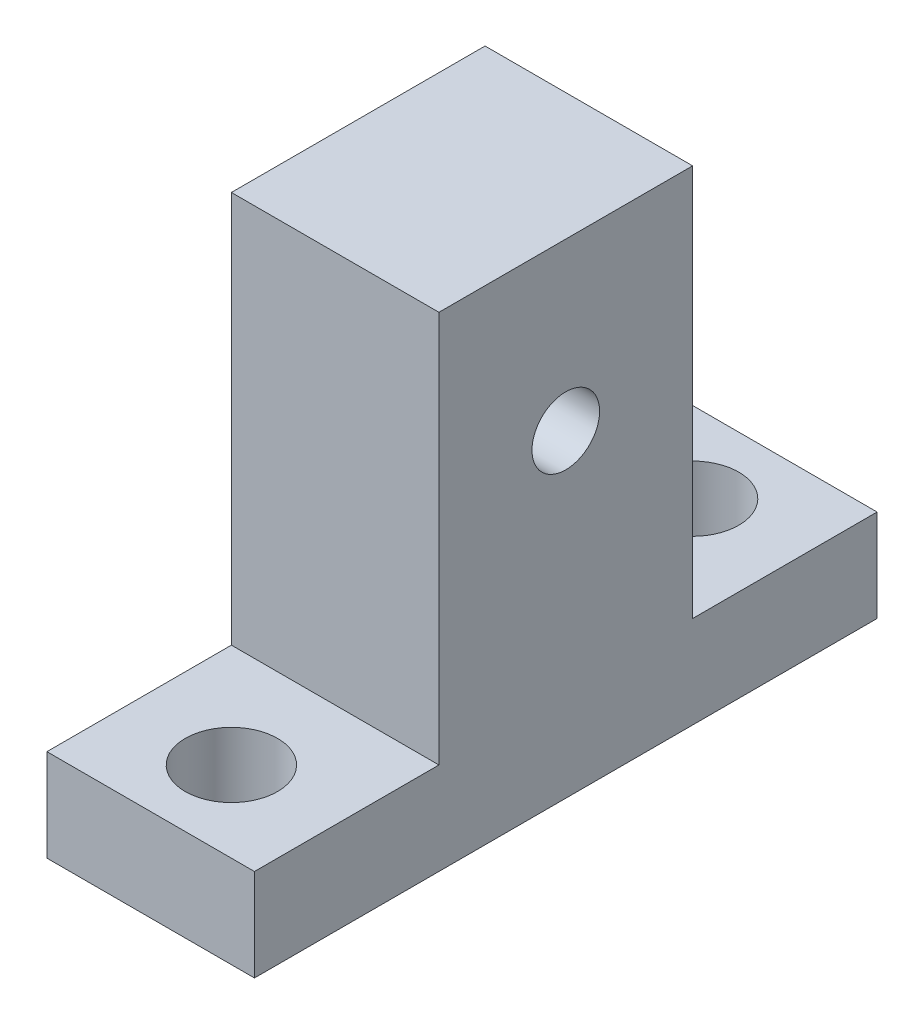
from build123d import *

# Parameters (mm, degrees)
SKETCH1_R           = 2.328333333
BOSS_EXTRUDE1_DEPTH = 14.2875
SKETCH2_R           = 3.175
CUT_EXTRUDE1_DEPTH  = 14.2875


with BuildPart() as part:
    # Sketch1 → Boss-Extrude1 (new body)
    with BuildSketch(Plane(origin=(0, 0, 0), x_dir=(0, 0, -1), z_dir=(1, 0, 0))):
        Polygon((0, 0), (42.8625, 0), (42.8625, 6.35), (30.1625, 6.35), (30.1625, 33.3375), (12.7, 33.3375), (12.7, 6.35), (0, 6.35), align=None)
        with Locations((21.43125, 21.9075)):
            Circle(SKETCH1_R, mode=Mode.SUBTRACT)
    extrude(amount=BOSS_EXTRUDE1_DEPTH)

    # Sketch2 → Cut-Extrude1 (cut)
    with BuildSketch(Plane(origin=(0, 6.35, 0), x_dir=(1, 0, 0), z_dir=(0, 1, 0))):
        with Locations(Location((7.14375, 5.55625, 0), (0, 0, 270))):
            Circle(SKETCH2_R)
        with Locations(Location((7.14375, 37.30625, 0), (0, 0, 270))):
            Circle(SKETCH2_R)
    extrude(amount=-CUT_EXTRUDE1_DEPTH, mode=Mode.SUBTRACT)


solid = part.part
